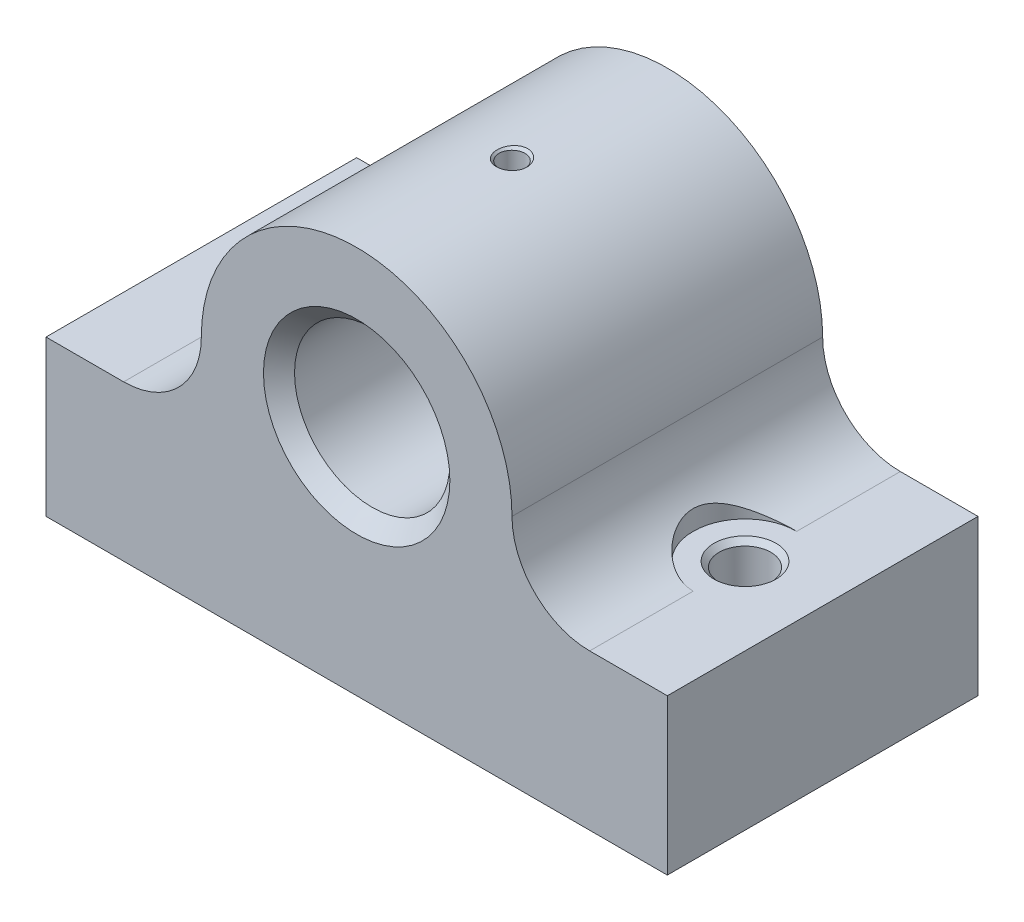
from build123d import *

# Parameters (mm, degrees)
SKETCH1_W                   = 120
SKETCH1_H                   = 60
BOSS_EXTRUDE1_DEPTH         = 30
SKETCH2_R                   = 30
BOSS_EXTRUDE2_DEPTH         = 60
SKETCH3_R                   = 15
CUT_EXTRUDE1_DEPTH          = 114.247516529
CHAMFER1_SIZE               = 3
FILLET2_R                   = 15
SKETCH4_R                   = 10
CUT_EXTRUDE2_DEPTH          = 5
SKETCH5_R                   = 5
CUT_EXTRUDE3_DEPTH          = 81.777472144
CHAMFER2_SIZE               = 1
M6_TAPPED_HOLE2_D           = 5
M6_TAPPED_HOLE2_DEPTH       = 29.999
M6_TAPPED_HOLE2_CSINK_D     = 6.05
M6_TAPPED_HOLE2_CSINK_ANGLE = 90
M6_TAPPED_HOLE2_TIP         = 1.502151548


with BuildPart() as part:
    # Sketch1 → Boss-Extrude1 (new body)
    with BuildSketch(Plane(origin=(0, 0, 0), x_dir=(1, 0, 0), z_dir=(0, 1, 0))):
        Rectangle(SKETCH1_W, SKETCH1_H)
    extrude(amount=BOSS_EXTRUDE1_DEPTH)

    # Sketch2 → Boss-Extrude2 (add)
    with BuildSketch(Plane.XY.offset(30)):
        with Locations((0, 45)):
            Circle(SKETCH2_R)
    extrude(amount=-BOSS_EXTRUDE2_DEPTH)

    # Sketch3 → Cut-Extrude1 (cut, through all)
    with BuildSketch(Plane.XY.offset(30)):
        with Locations((0, 45)):
            Circle(SKETCH3_R)
    extrude(amount=-CUT_EXTRUDE1_DEPTH, mode=Mode.SUBTRACT)

    # Chamfer1
    chamfer1_edges = [part.edges().sort_by_distance(p)[0] for p in [
        (-15, 45, -30),
        (-15, 45, 30),
    ]]
    chamfer(chamfer1_edges, length=CHAMFER1_SIZE)

    # Fillet2
    fillet2_edges = [part.edges().sort_by_distance(p)[0] for p in [
        (-25.980762114, 30, 0),
        (25.980762114, 30, 0),
    ]]
    fillet(fillet2_edges, radius=FILLET2_R)

    # Sketch4 → Cut-Extrude2 (cut)
    with BuildSketch(Plane(origin=(0, 30, 0), x_dir=(1, 0, 0), z_dir=(0, 1, 0))):
        with Locations((-45, 0)):
            Circle(SKETCH4_R)
        with Locations((45, 0)):
            Circle(SKETCH4_R)
    extrude(amount=CUT_EXTRUDE2_DEPTH, mode=Mode.SUBTRACT)

    # Sketch5 → Cut-Extrude3 (cut, through all)
    with BuildSketch(Plane(origin=(0, 30, 0), x_dir=(1, 0, 0), z_dir=(0, 1, 0))):
        with Locations(Location((-45, 0, 0), (0, 0, 270))):
            Circle(SKETCH5_R)
        with Locations(Location((45, 0, 0), (0, 0, 270))):
            Circle(SKETCH5_R)
    extrude(amount=-CUT_EXTRUDE3_DEPTH, mode=Mode.SUBTRACT)

    # Chamfer2
    chamfer2_edges = [part.edges().sort_by_distance(p)[0] for p in [
        (-45, 30, -5),
        (45, 30, -5),
    ]]
    chamfer(chamfer2_edges, length=CHAMFER2_SIZE)

    # M6 Tapped Hole2
    with Locations(Plane(origin=(0, 75, 0), x_dir=(1, 0, 0), z_dir=(0, 1, 0))):
        with Locations((0, 0)):
            CounterSinkHole(M6_TAPPED_HOLE2_D / 2, M6_TAPPED_HOLE2_CSINK_D / 2, depth=M6_TAPPED_HOLE2_DEPTH, counter_sink_angle=M6_TAPPED_HOLE2_CSINK_ANGLE)
            with Locations((0, 0, -(M6_TAPPED_HOLE2_DEPTH + M6_TAPPED_HOLE2_TIP / 2))):  # 118° drill point
                Cone(0, M6_TAPPED_HOLE2_D / 2, M6_TAPPED_HOLE2_TIP, mode=Mode.SUBTRACT)


solid = part.part
